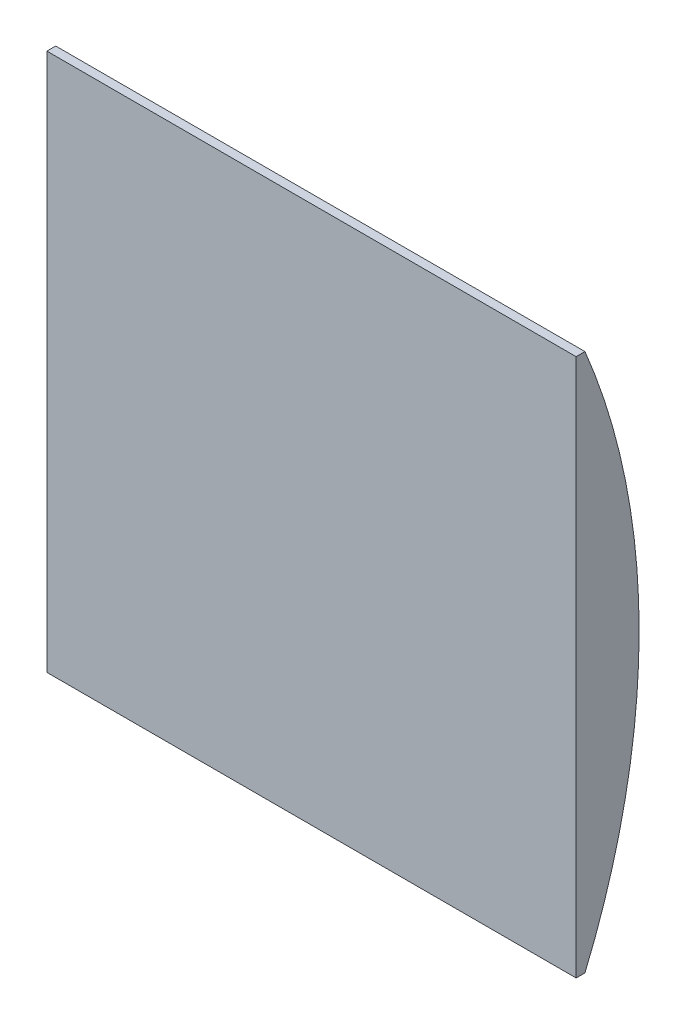
from build123d import *

# Parameters (mm, degrees)
BOSS_EXTRUDE1_DEPTH = 300
SKETCH3_W           = 50
SKETCH3_H           = 250
CUT_EXTRUDE1_DEPTH  = 20


with BuildPart() as part:
    # Sketch2 → Boss-Extrude1 (new body)
    with BuildSketch(Plane(origin=(0, 0, 0), x_dir=(0, 0, -1), z_dir=(1, 0, 0))):
        with BuildLine():
            Line((-8.879310345, 278.103448276), (-8.879310345, -26.896551724))
            Line((-8.879310345, -26.896551724), (-3.879310345, -26.896551724))
            ThreePointArc((-3.879310345, -26.896551724), (26.804536977, 125.603448276), (-3.879310345, 278.103448276))
            Line((-3.879310345, 278.103448276), (-8.879310345, 278.103448276))
        make_face()
    extrude(amount=BOSS_EXTRUDE1_DEPTH)

    # Sketch3 → Cut-Extrude1 (cut)
    with BuildSketch(Plane(origin=(0, 0, -26.804536977), x_dir=(-1, 0, 0), z_dir=(0, 0, -1))):
        with Locations((-225, 153.103448276)):
            Rectangle(SKETCH3_W, SKETCH3_H)
        with Locations((-75, 153.103448276)):
            Rectangle(SKETCH3_W, SKETCH3_H)
    extrude(amount=-CUT_EXTRUDE1_DEPTH, mode=Mode.SUBTRACT)


solid = part.part
